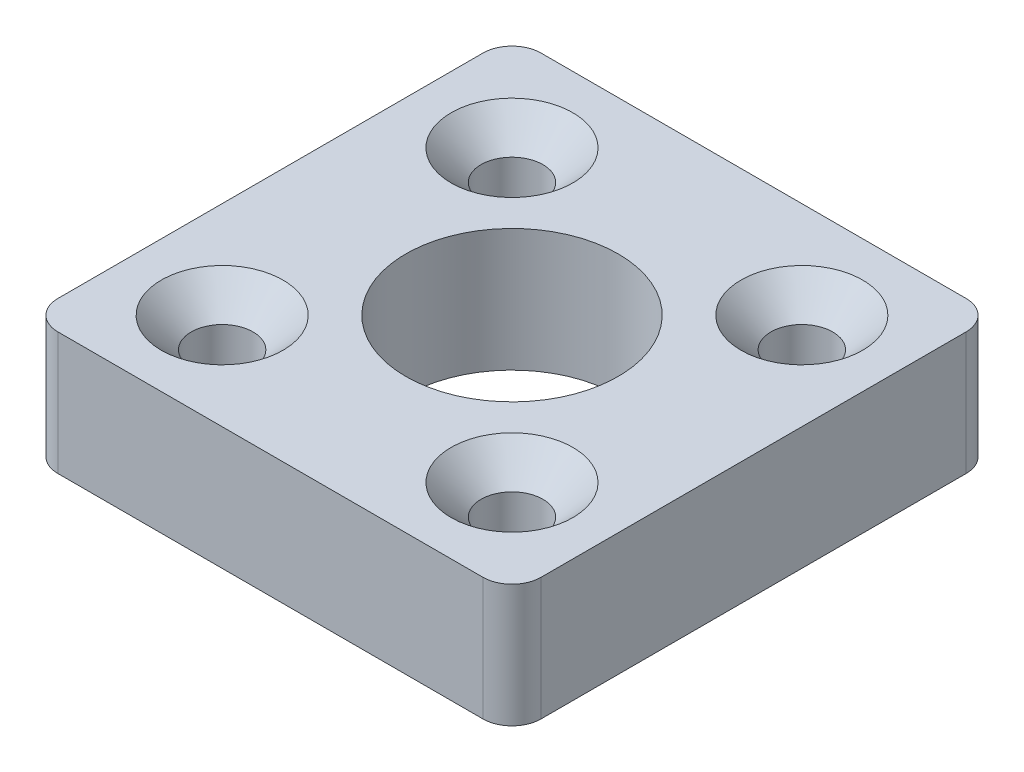
from build123d import *

# Parameters (mm, degrees)
SKETCH2_W                                       = 50
SKETCH2_H                                       = 50
SKETCH2_R                                       = 10.993
BOSS_EXTRUDE1_DEPTH                             = 12.7
CSK_FOR_M6_FLAT_HEAD_MACHINE_SCREW1_D           = 6.4
CSK_FOR_M6_FLAT_HEAD_MACHINE_SCREW1_CSINK_D     = 12.6
CSK_FOR_M6_FLAT_HEAD_MACHINE_SCREW1_CSINK_ANGLE = 90
FILLET1_R                                       = 3


with BuildPart() as part:
    # Sketch2 → Boss-Extrude1 (new body)
    with BuildSketch(Plane(origin=(0, 0, 0), x_dir=(1, 0, 0), z_dir=(0, 1, 0))):
        Rectangle(SKETCH2_W, SKETCH2_H)
        with Locations(Location((0, 0, 0), (0, 0, 270))):
            Circle(SKETCH2_R, mode=Mode.SUBTRACT)
    extrude(amount=-BOSS_EXTRUDE1_DEPTH)

    # CSK for M6 Flat Head Machine Screw1 (through all)
    with Locations(Plane(origin=(-15, 0, 15), x_dir=(0, 0, 1), z_dir=(0, 1, 0))):
        with Locations((0, 0), (0, 30), (-30, 0), (-30, 30)):
            CounterSinkHole(CSK_FOR_M6_FLAT_HEAD_MACHINE_SCREW1_D / 2, CSK_FOR_M6_FLAT_HEAD_MACHINE_SCREW1_CSINK_D / 2, counter_sink_angle=CSK_FOR_M6_FLAT_HEAD_MACHINE_SCREW1_CSINK_ANGLE)

    # Fillet1
    fillet1_edges = [part.edges().sort_by_distance(p)[0] for p in [
        (-25, -6.35, -25),
        (25, -6.35, -25),
        (25, -6.35, 25),
        (-25, -6.35, 25),
    ]]
    fillet(fillet1_edges, radius=FILLET1_R)


solid = part.part
